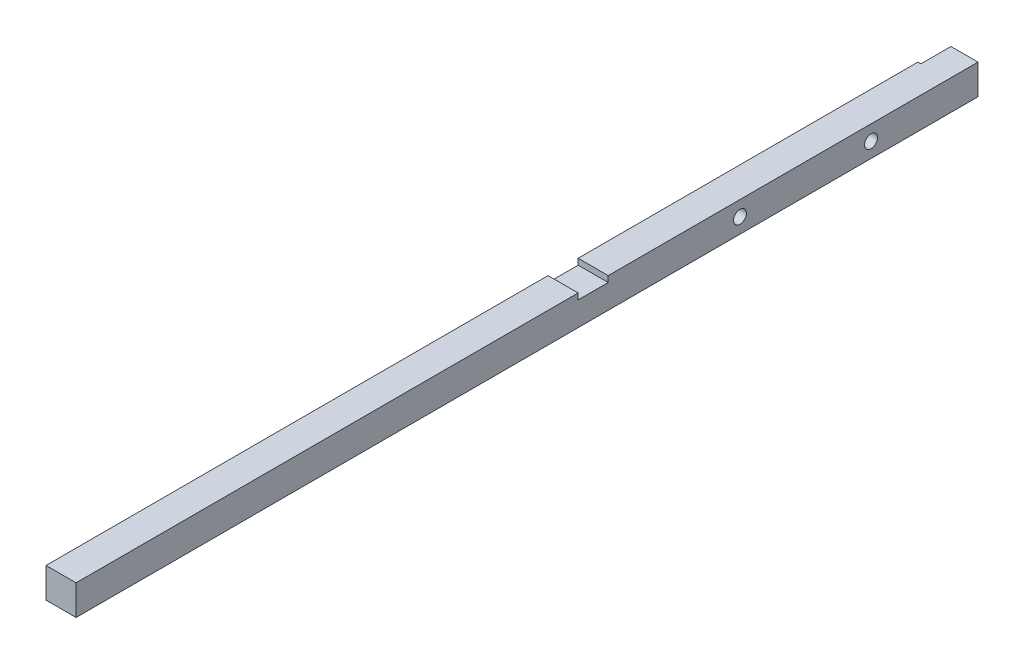
from build123d import *

# Parameters (mm, degrees)
BOSS_EXTRU_1_START      = 7
ESQUISSE1_W             = 10
ESQUISSE1_H             = 10
BOSS_EXTRU_1_DEPTH      = 300
ESQUISSE4_W             = 10
ESQUISSE4_H             = 2
ENL_V_MAT_EXTRU_3_DEPTH = 308.203515605
ESQUISSE6_W             = 10
ESQUISSE6_H             = 10
ENL_V_MAT_EXTRU_5_DEPTH = 1
D_GAGEMENT_M41_D        = 4.3


with BuildPart() as part:
    # Esquisse1 → Boss.-Extru.1 (new body)
    with BuildSketch(Plane.XY.offset(BOSS_EXTRU_1_START)):
        Rectangle(ESQUISSE1_W, ESQUISSE1_H)
    extrude(amount=BOSS_EXTRU_1_DEPTH)

    # Esquisse4 → Enlèv. mat.-Extru.3 (cut, through all)
    with BuildSketch(Plane(origin=(5, 0, 0), x_dir=(0, 0, -1), z_dir=(1, 0, 0))):
        with Locations((-135, 4)):
            Rectangle(ESQUISSE4_W, ESQUISSE4_H)
    extrude(amount=-ENL_V_MAT_EXTRU_3_DEPTH, mode=Mode.SUBTRACT)

    # Esquisse6 → Enlèv. mat.-Extru.5 (cut)
    with BuildSketch(Plane.ZY.offset(5)):
        with Locations((12, 0)):
            Rectangle(ESQUISSE6_W, ESQUISSE6_H)
    extrude(amount=-ENL_V_MAT_EXTRU_5_DEPTH, mode=Mode.SUBTRACT)

    # Dégagement M41 (through all)
    with Locations(Plane.ZY.offset(5)):
        with Locations((86.186482928, 0), (42.586482928, 0)):
            Hole(D_GAGEMENT_M41_D / 2)


solid = part.part
